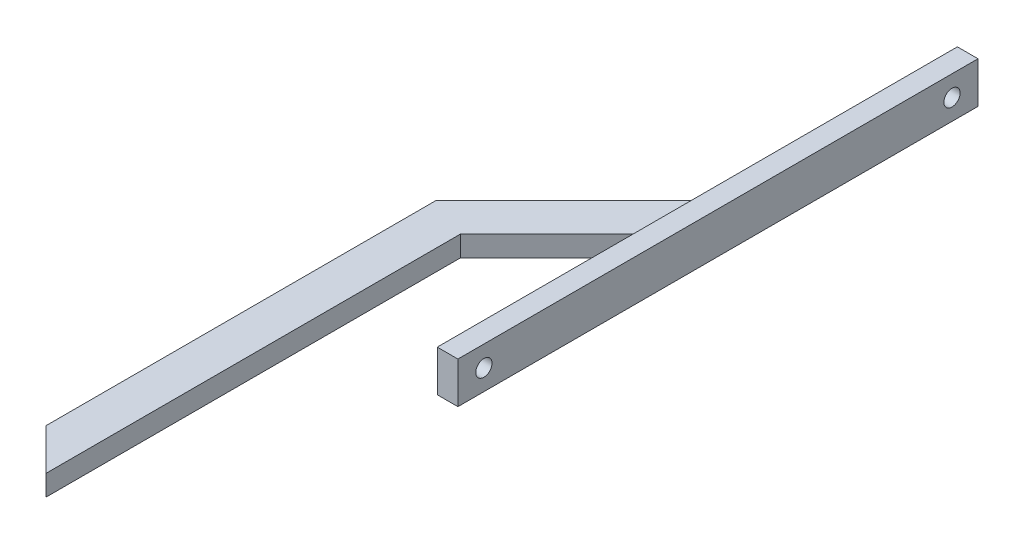
from build123d import *

# Parameters (mm, degrees)
BOSS_EXTRUDE1_DEPTH      = 80
BOSS_EXTRUDE1_DEPTH_BACK = 80
SKETCH2_W                = 6.35
SKETCH2_H                = 12.7
SKETCH4_R                = 2.5
CUT_EXTRUDE1_DEPTH       = 81.502453379
BOSS_EXTRUDE2_DEPTH      = 3.175
BOSS_EXTRUDE2_DEPTH_BACK = 3.175


with BuildPart() as part:
    # Sketch2 → Boss-Extrude1 (new, two sides: drawn at the far end of the back side and taken through both)
    with BuildSketch(Plane.XY.offset(-BOSS_EXTRUDE1_DEPTH_BACK)):
        Rectangle(SKETCH2_W, SKETCH2_H)
    extrude(amount=BOSS_EXTRUDE1_DEPTH + BOSS_EXTRUDE1_DEPTH_BACK)

    # Sketch4 → Cut-Extrude1 (cut, through all)
    with BuildSketch(Plane(origin=(3.175, 0, 0), x_dir=(0, 0, -1), z_dir=(1, 0, 0))):
        with Locations((-72, 0)):
            Circle(SKETCH4_R)
        with Locations((72, 0)):
            Circle(SKETCH4_R)
    extrude(amount=-CUT_EXTRUDE1_DEPTH, mode=Mode.SUBTRACT)

    # Sketch5 → Boss-Extrude2 (add, two sides: drawn at the far end of the back side and taken through both)
    with BuildSketch(Plane(origin=(0, 0, 0), x_dir=(0, 0, -1), z_dir=(0, 1, 0)).offset(-BOSS_EXTRUDE2_DEPTH_BACK)):
        Polygon((4.490128061, 3.175), (-37.936278811, 45.601406871), (-157.936278811, 45.601406871), (-170.636278811, 32.901406871), (-43.196791053, 32.901406871), (-7.120384182, -3.175), (-1.859871939, -3.175), align=None)
    extrude(amount=BOSS_EXTRUDE2_DEPTH + BOSS_EXTRUDE2_DEPTH_BACK)


solid = part.part
